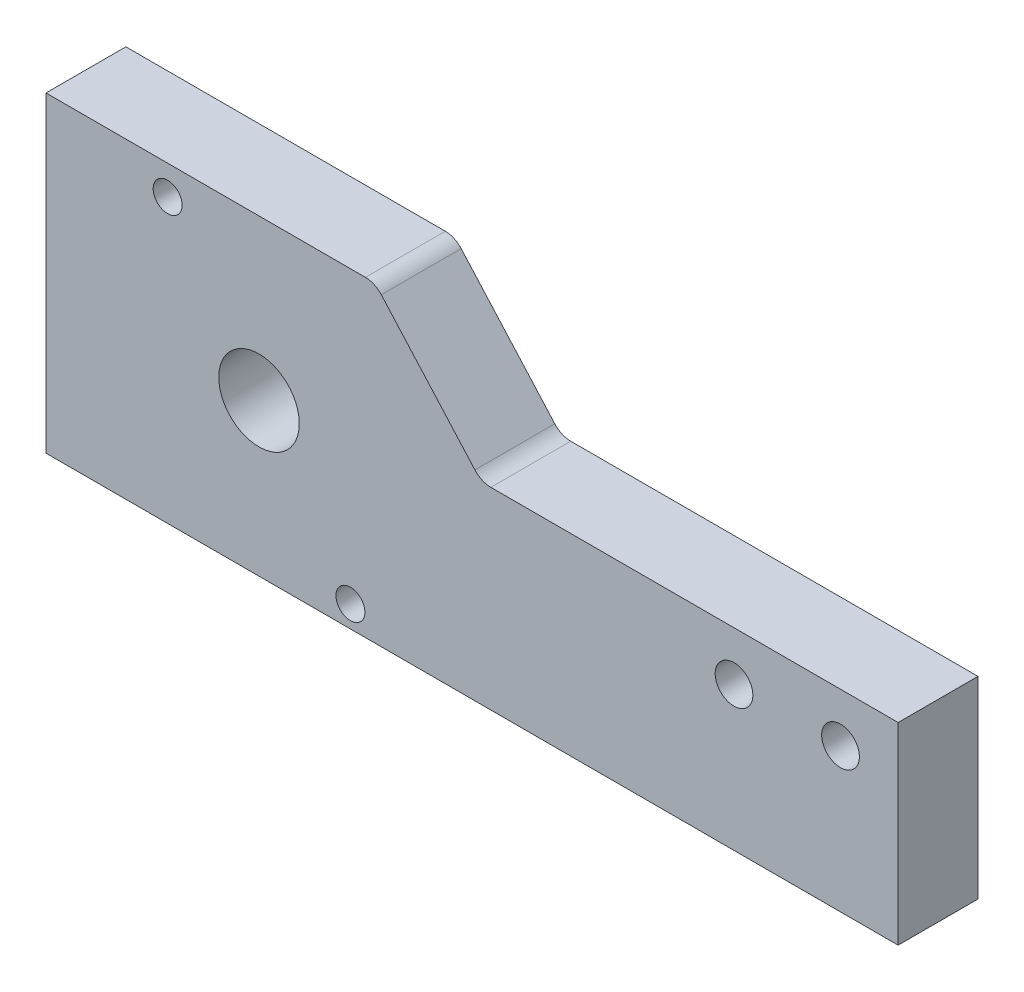
from build123d import *

# Parameters (mm, degrees)
SKETCH1_W                 = 101.6
SKETCH1_H                 = 50.8
BOSS_EXTRUDE1_DEPTH       = 9.525
SKETCH6_R                 = 4.8
CUT_EXTRUDE1_DEPTH        = 58.589283942
TAP_DRILL_FOR_8_32_TAP1_D = 3.4544
F_8_CLEARANCE_HOLE1_D     = 4.4958
SKETCH10_W                = 101.6
SKETCH10_H                = 37.138907791
CUT_EXTRUDE2_DEPTH        = 58.589283942
CUT_EXTRUDE3_DEPTH        = 58.589283942
FILLET1_R                 = 2.54


with BuildPart() as part:
    # Sketch1 → Boss-Extrude1 (new body)
    with BuildSketch(Plane.XY):
        Rectangle(SKETCH1_W, SKETCH1_H)
    extrude(amount=BOSS_EXTRUDE1_DEPTH)

    # Sketch6 → Cut-Extrude1 (cut, through all)
    with BuildSketch(Plane.XY):
        with Locations(Location((-25.4, 6.35, 0), (0, 0, 180))):
            Circle(SKETCH6_R)
    extrude(amount=CUT_EXTRUDE1_DEPTH, mode=Mode.SUBTRACT)

    # Tap Drill for #8-32 Tap1 (through all)
    with Locations(Plane.XY.offset(9.525)):
        with Locations((-14.502047709, -9.213888841), (-36.297952291, 21.913888841)):
            Hole(TAP_DRILL_FOR_8_32_TAP1_D / 2)

    # #8 Clearance Hole1 (through all)
    with Locations(Plane.XY.offset(9.525)):
        with Locations((31.231814057, 5.34348178), (43.931814057, 5.34348178)):
            Hole(F_8_CLEARANCE_HOLE1_D / 2)

    # Sketch10 → Cut-Extrude2 (cut, through all)
    with BuildSketch(Plane.XY.offset(9.525)):
        with Locations((0, -30.370972115)):
            Rectangle(SKETCH10_W, SKETCH10_H)
    extrude(amount=-CUT_EXTRUDE2_DEPTH, mode=Mode.SUBTRACT)

    # Sketch11 → Cut-Extrude3 (cut, through all)
    with BuildSketch(Plane.XY.offset(9.525)):
        Polygon((50.8, 11.193885079), (1.096095255, 11.193885079), (-11.576646979, 25.4), (50.8, 25.4), align=None)
    extrude(amount=-CUT_EXTRUDE3_DEPTH, mode=Mode.SUBTRACT)

    # Fillet1
    fillet1_edges = [part.edges().sort_by_distance(p)[0] for p in [
        (1.096095255, 11.193885079, 4.7625),
        (-11.576646979, 25.4, 4.7625),
    ]]
    fillet(fillet1_edges, radius=FILLET1_R)


solid = part.part
